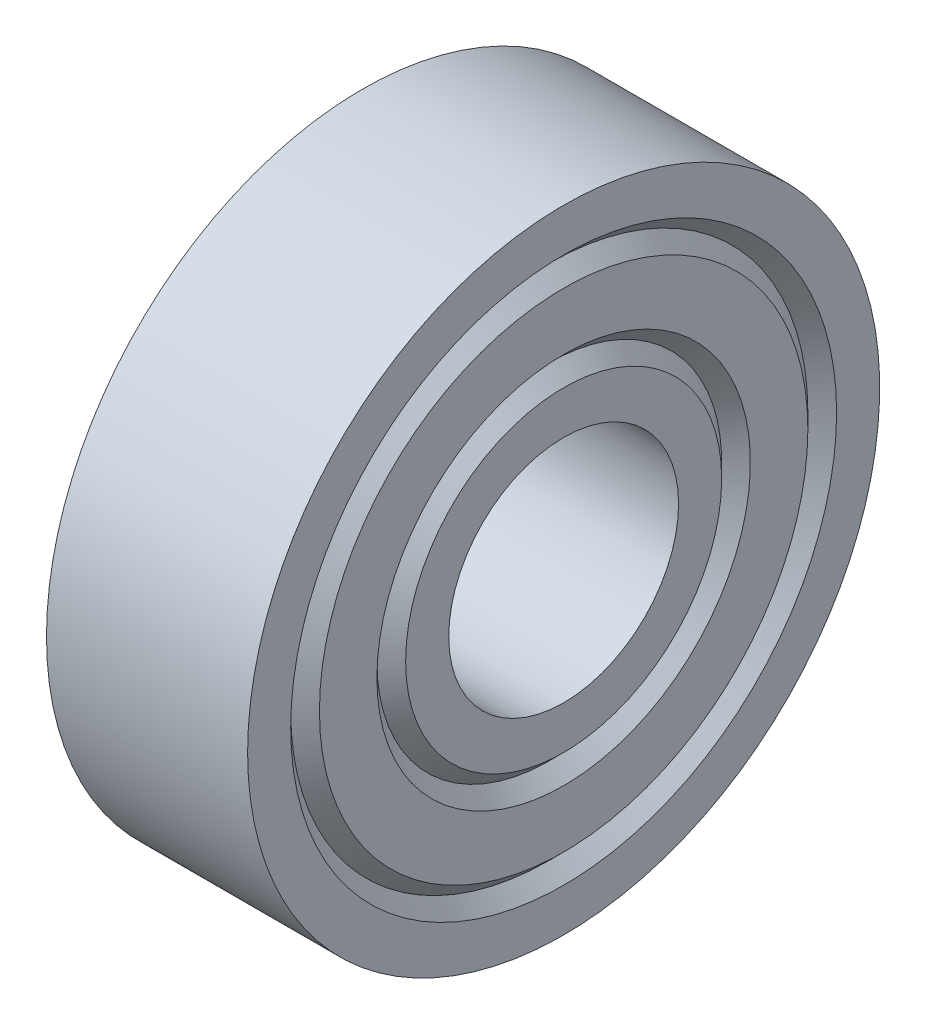
from build123d import *


with BuildPart() as part:
    # Esquisse1 → Base-Révolution (revolve)
    with BuildSketch(Plane.XY, mode=Mode.PRIVATE) as base_r_volution_sk:
        Polygon((-3.5, 4), (3.5, 4), (3.5, 5.5), (3, 6), (3.5, 6.5), (3.5, 8.5), (3, 9), (3.5, 9.5), (3.5, 11), (-3.5, 11), (-3.5, 9.5), (-3, 9), (-3.5, 8.5), (-3.5, 6.5), (-3, 6), (-3.5, 5.5), align=None)
    revolve(base_r_volution_sk.sketch.rotate(Axis((0, 0, 0), (1, 0, 0)), 90), axis=Axis((0, 0, 0), (1, 0, 0)))


solid = part.part
